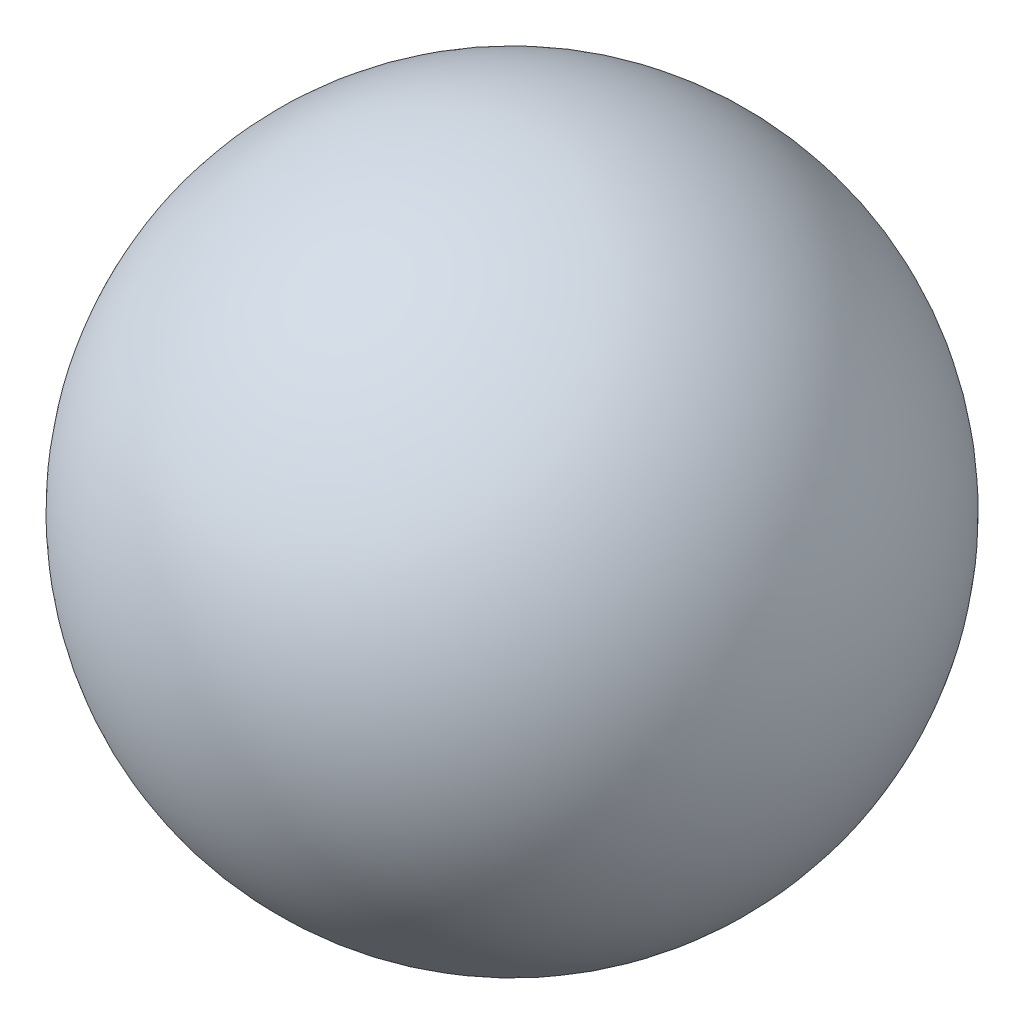
from build123d import *


with BuildPart() as part:
    # Sketch1 → Revolve1 (revolve)
    with BuildSketch(Plane.XY):
        with BuildLine():
            Line((12.7, 0), (-12.7, 0))
            ThreePointArc((-12.7, 0), (0, 12.7), (12.7, 0))
        make_face()
    revolve(axis=Axis((12.7, 0, 0), (-1, 0, 0)))


solid = part.part
